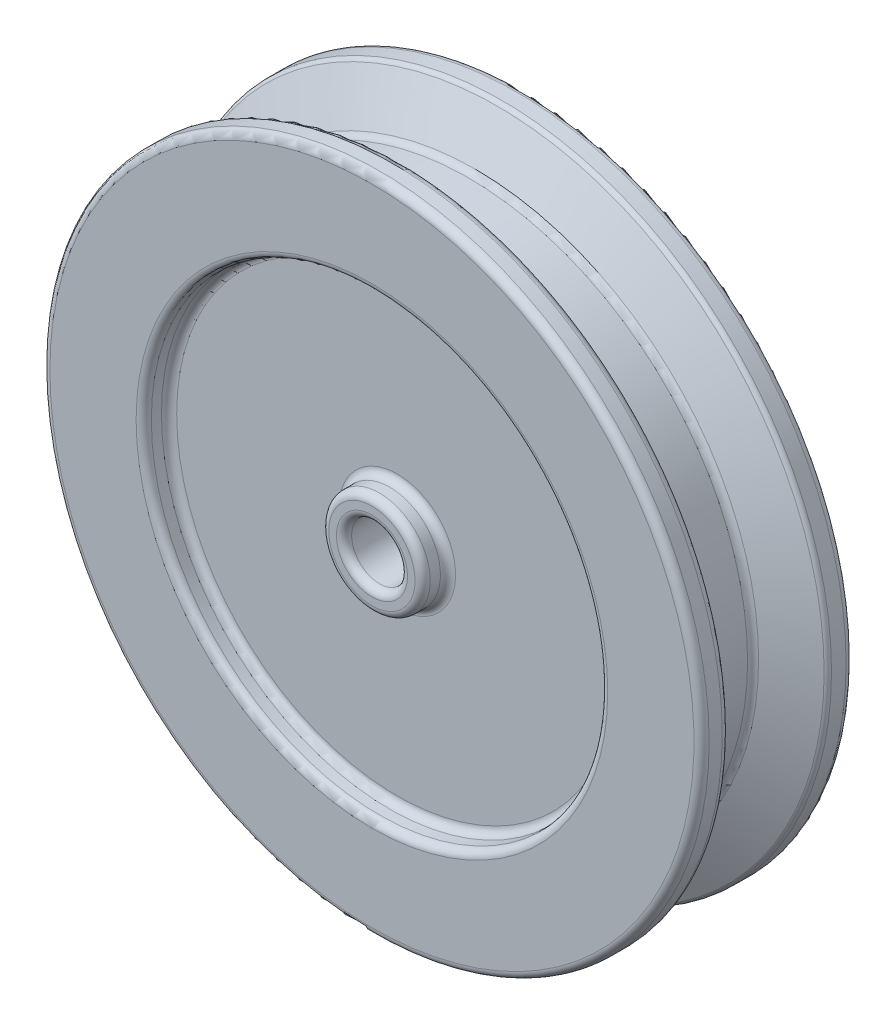
from build123d import *

# Parameters (mm, degrees)
FILLET17_R = 0.762
FILLET22_R = 0.508


with BuildPart() as part:
    # Sketch1 → Revolve1 (revolve)
    with BuildSketch(Plane(origin=(0, 0, 0), x_dir=(0, 0, -1), z_dir=(1, 0, 0)), mode=Mode.PRIVATE) as revolve1_sk:
        Polygon((0, 2.794), (7.62, 2.794), (7.62, 5.08), (5.08, 5.08), (5.08, 22.86), (7.62, 22.86), (7.62, 33.02), (5.08, 33.02), (2.54, 27.94), (0, 27.94), align=None)
    revolve1 = revolve(revolve1_sk.sketch.rotate(Axis((0, 0, 0), (0, 0, -1)), 90), axis=Axis((0, 0, 0), (0, 0, -1)))

    # Mirror1: Revolve1 across plane
    add(revolve1.mirror(Plane(origin=(0, 27.94, 0), x_dir=(1, 0, 0), z_dir=(0, 0, -1))))

    # Fillet17
    fillet17_edges = [part.edges().sort_by_distance(p)[0] for p in [
        (-22.86, 0, -5.08),
        (-5.08, 0, -5.08),
        (-5.08, 0, -7.62),
        (-2.794, 0, -7.62),
        (-2.794, 0, 7.62),
        (-5.08, 0, 7.62),
        (-5.08, 0, 5.08),
        (-22.86, 0, 5.08),
        (-22.86, 0, 7.62),
        (-33.02, 0, 7.62),
        (-33.02, 0, 5.08),
        (-27.94, 0, 2.54),
        (-27.94, 0, -2.54),
        (-33.02, 0, -7.62),
        (-22.86, 0, -7.62),
    ]]
    fillet(fillet17_edges, radius=FILLET17_R)

    # Fillet22
    fillet22_edges = [part.edges().sort_by_distance(p)[0] for p in [
        (-33.02, 0, -5.08),
    ]]
    fillet(fillet22_edges, radius=FILLET22_R)


solid = part.part
